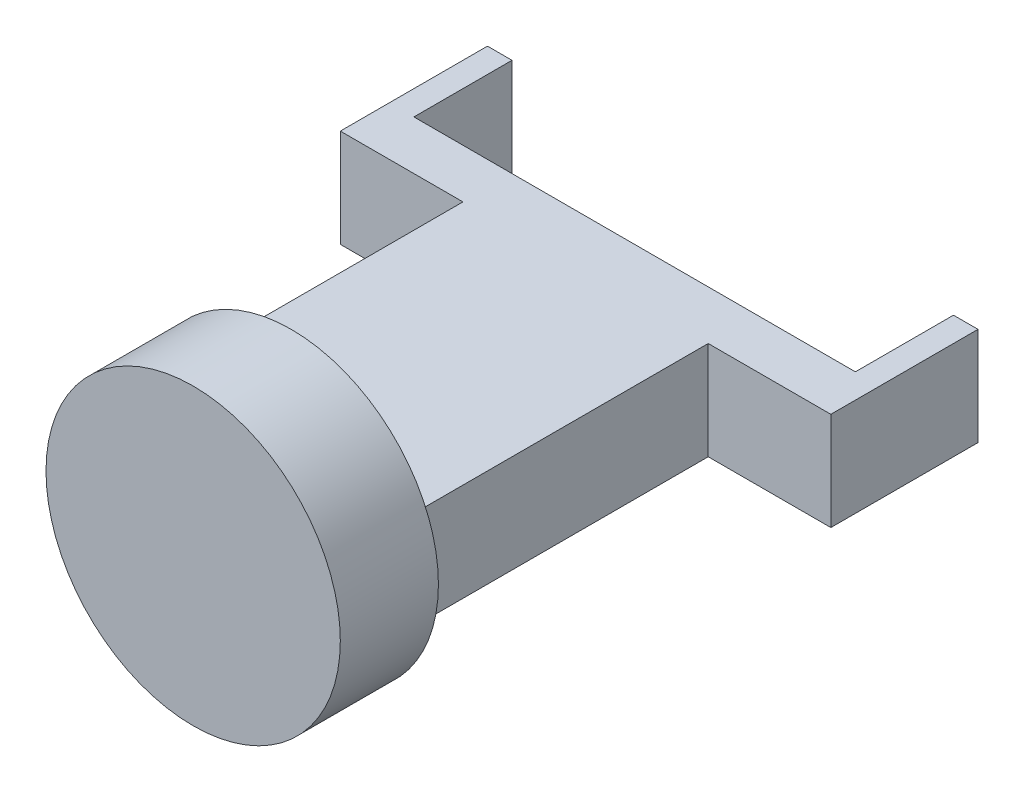
from build123d import *

# Parameters (mm, degrees)
SKETCH1_R           = 30
BOSS_EXTRUDE1_DEPTH = 20
SKETCH3_W           = 50
SKETCH3_H           = 20
BOSS_EXTRUDE2_DEPTH = 60
SKETCH4_W           = 100
SKETCH4_H           = 20
BOSS_EXTRUDE3_DEPTH = 10
SKETCH5_W           = 5
SKETCH5_H           = 20
BOSS_EXTRUDE4_DEPTH = 20


with BuildPart() as part:
    # Sketch1 → Boss-Extrude1 (new body)
    with BuildSketch(Plane.XY):
        Circle(SKETCH1_R)
    extrude(amount=-BOSS_EXTRUDE1_DEPTH)

    # Sketch3 → Boss-Extrude2 (add)
    with BuildSketch(Plane(origin=(0, 0, -20), x_dir=(-1, 0, 0), z_dir=(0, 0, -1))):
        Rectangle(SKETCH3_W, SKETCH3_H)
    extrude(amount=BOSS_EXTRUDE2_DEPTH)

    # Sketch4 → Boss-Extrude3 (add)
    with BuildSketch(Plane(origin=(0, 0, -80), x_dir=(-1, 0, 0), z_dir=(0, 0, -1))):
        Rectangle(SKETCH4_W, SKETCH4_H)
    extrude(amount=BOSS_EXTRUDE3_DEPTH)

    # Sketch5 → Boss-Extrude4 (add)
    with BuildSketch(Plane(origin=(0, 0, -90), x_dir=(-1, 0, 0), z_dir=(0, 0, -1))):
        with Locations((-47.5, 0)):
            Rectangle(SKETCH5_W, SKETCH5_H)
        with Locations((47.5, 0)):
            Rectangle(SKETCH5_W, SKETCH5_H)
    extrude(amount=BOSS_EXTRUDE4_DEPTH)


solid = part.part
